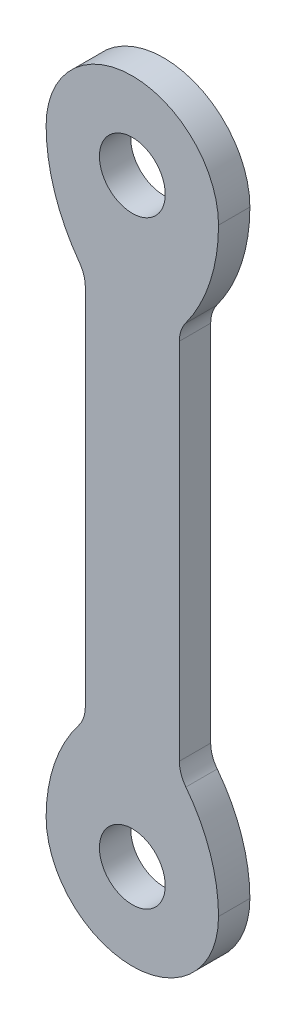
from build123d import *

# Parameters (mm, degrees)
BOSS_EXTRUDE1_DEPTH = 10
CUT_EXTRUDE1_REACH  = 222.451
SKETCH2_R           = 10.5


with BuildPart() as part:
    # Sketch1 → Boss-Extrude1 (new body)
    with BuildSketch(Plane.XY):
        with BuildLine():
            Line((-15, 152.675725708), (-15, 36.657195747))
            ThreePointArc((-15, 36.657195747), (-15.535152757, 33.429709625), (-17.083333333, 30.547663122))
            ThreePointArc((-17.083333333, 30.547663122), (-24.824236215, 16.137430609), (-27.5, 0))
            ThreePointArc((-27.5, 0), (0, -27.5), (27.5, 0))
            ThreePointArc((27.5, 0), (24.824236215, 16.137430609), (17.083333333, 30.547663122))
            ThreePointArc((17.083333333, 30.547663122), (15.535152757, 33.429709625), (15, 36.657195747))
            Line((15, 36.657195747), (15, 152.675725708))
            ThreePointArc((15, 152.675725708), (15.49291762, 155.776594073), (16.923076923, 158.571767907))
            ThreePointArc((16.923076923, 158.571767907), (24.788953091, 173.945223994), (27.5, 191))
            ThreePointArc((27.5, 191), (0, 218.5), (-27.5, 191))
            ThreePointArc((-27.5, 191), (-24.788953091, 173.945223994), (-16.923076923, 158.571767907))
            ThreePointArc((-16.923076923, 158.571767907), (-15.49291762, 155.776594073), (-15, 152.675725708))
        make_face()
    extrude(amount=BOSS_EXTRUDE1_DEPTH)

    # Sketch2 → Cut-Extrude1 (cut, up to next)
    with BuildSketch(Plane.XY.offset(10), mode=Mode.PRIVATE) as cut_extrude1_sk1:
        with Locations((0, 191)):
            Circle(SKETCH2_R)
    cut_extrude1_tool1 = extrude(cut_extrude1_sk1.sketch, amount=-CUT_EXTRUDE1_REACH, mode=Mode.PRIVATE) & part.part
    # Sketch2 → Cut-Extrude1 (cut, up to next)
    with BuildSketch(Plane.XY.offset(10), mode=Mode.PRIVATE) as cut_extrude1_sk2:
        Circle(SKETCH2_R)
    cut_extrude1_tool2 = extrude(cut_extrude1_sk2.sketch, amount=-CUT_EXTRUDE1_REACH, mode=Mode.PRIVATE) & part.part
    add(cut_extrude1_tool1.solids().sort_by_distance((0, 191, 10))[0], mode=Mode.SUBTRACT)
    add(cut_extrude1_tool2.solids().sort_by_distance((0, 0, 10))[0], mode=Mode.SUBTRACT)


solid = part.part
